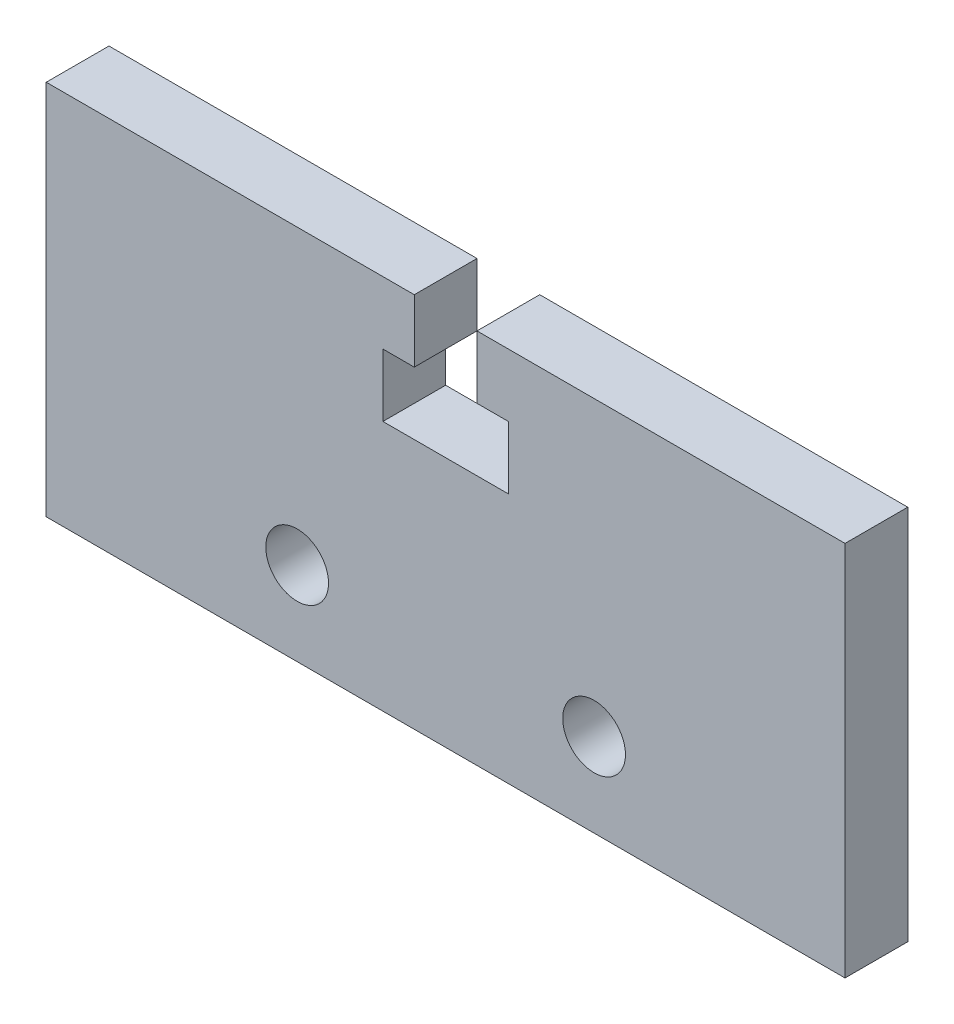
from build123d import *

# Parameters (mm, degrees)
CROQUIS1_R              = 1.5
SALIENTE_EXTRUIR1_DEPTH = 3


with BuildPart() as part:
    # Croquis1 → Saliente-Extruir1 (new body)
    with BuildSketch(Plane.XY):
        Polygon((19.1, -9), (-19.1, -9), (-19.1, 9), (-1.5, 9), (-1.5, 6), (-3, 6), (-3, 3), (3, 3), (3, 6), (1.5, 6), (1.5, 9), (19.1, 9), align=None)
        with Locations((7.1, -5)):
            Circle(CROQUIS1_R, mode=Mode.SUBTRACT)
        with Locations(Location((-7.1, -5, 0), (0, 0, 180))):
            Circle(CROQUIS1_R, mode=Mode.SUBTRACT)
    extrude(amount=SALIENTE_EXTRUIR1_DEPTH)


solid = part.part
